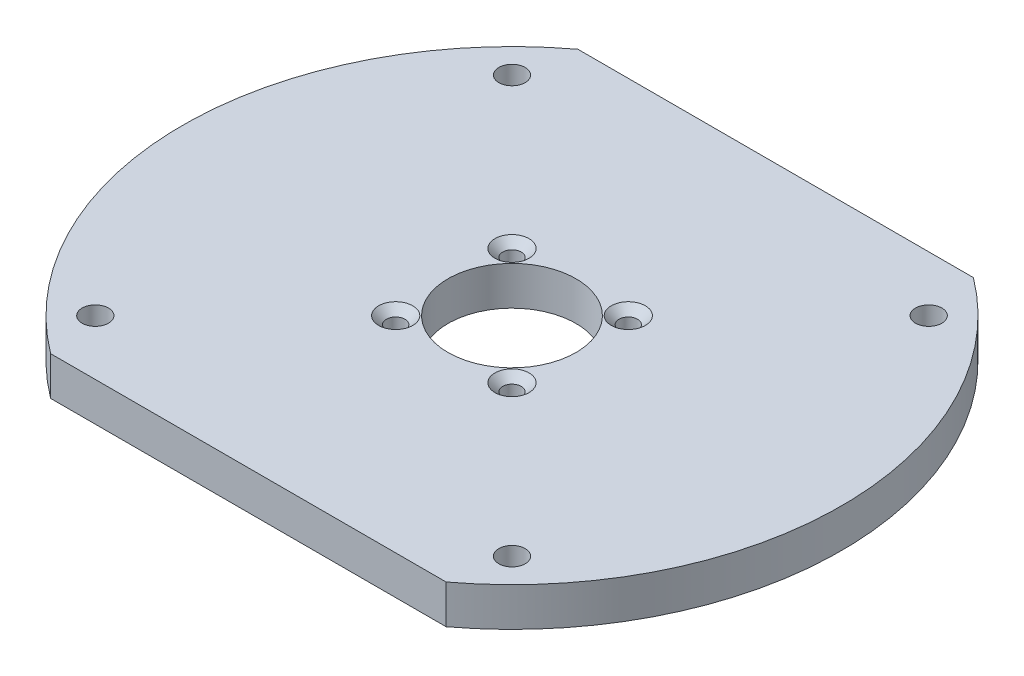
from build123d import *

# Parameters (mm, degrees)
SKETCH_1_R                   = 42.5
EXTRUDE_1_DEPTH              = 5
SKETCH_2_R                   = 8.25
CUT_EXTRUDE_1_DEPTH          = 61.311690409
HOLE_WIZARD_M2_1_D           = 2.4
HOLE_WIZARD_M2_1_CSINK_D     = 4.4
HOLE_WIZARD_M2_1_CSINK_ANGLE = 90
HOLE_WIZARD_M3_1_D           = 3.4
HOLE_WIZARD_M3_1_CSINK_D     = 6.3
HOLE_WIZARD_M3_1_CSINK_ANGLE = 90
PATTERN_CIRCULAR_1_COUNT     = 4
CUT_EXTRUDE_2_DEPTH          = 61.311690409


with BuildPart() as part:
    # 草圖1 → 填料-伸長1 (new body)
    with BuildSketch(Plane(origin=(0, 0, 0), x_dir=(1, 0, 0), z_dir=(0, 1, 0))):
        Circle(SKETCH_1_R)
    extrude(amount=EXTRUDE_1_DEPTH)

    # 草圖2 → 除料-伸長1 (cut, through all)
    with BuildSketch(Plane(origin=(0, 5, 0), x_dir=(1, 0, 0), z_dir=(0, 1, 0))):
        Circle(SKETCH_2_R)
    extrude(amount=-CUT_EXTRUDE_1_DEPTH, mode=Mode.SUBTRACT)

    # M2 錐坑平頭螺釘的錐孔1 (through all)
    with Locations(Plane(origin=(0, 5, 0), x_dir=(1, 0, 0), z_dir=(0, 1, 0))):
        with Locations((-7.5, 7.5), (7.5, 7.5), (7.5, -7.5), (-7.5, -7.5)):
            CounterSinkHole(HOLE_WIZARD_M2_1_D / 2, HOLE_WIZARD_M2_1_CSINK_D / 2, counter_sink_angle=HOLE_WIZARD_M2_1_CSINK_ANGLE)

    # M3 錐坑平頭螺釘的錐孔1 (through all)
    with Locations(Plane(origin=(0, 0, 0), x_dir=(-1, 0, 0), z_dir=(0, -1, 0))):
        with Locations((26.870057685, -26.870057685)):
            hole_wizard_m3_1 = CounterSinkHole(HOLE_WIZARD_M3_1_D / 2, HOLE_WIZARD_M3_1_CSINK_D / 2, counter_sink_angle=HOLE_WIZARD_M3_1_CSINK_ANGLE)

    # 環狀複製排列1: M3 錐坑平頭螺釘的錐孔1 ×4 about axis
    pattern_circular_1_axis = Axis((0, 0, 0), (0, 1, 0))
    for i in range(1, PATTERN_CIRCULAR_1_COUNT):
        add(hole_wizard_m3_1.rotate(pattern_circular_1_axis, i * 360 / PATTERN_CIRCULAR_1_COUNT), mode=Mode.SUBTRACT)

    # 草圖7 → 除料-伸長2 (cut, symmetric)
    with BuildSketch(Plane(origin=(0, 5, 0), x_dir=(1, 0, 0), z_dir=(0, 1, 0))):
        Polygon((240.207107839, -34), (25.5, -34), (-25.5, -34), (-240.207107839, -34), (-240.207107839, -463.414215679), (240.207107839, -463.414215679), align=None)
    cut_extrude_2 = extrude(amount=CUT_EXTRUDE_2_DEPTH, both=True, mode=Mode.SUBTRACT)

    # 鏡射1: 除料-伸長2 across plane
    add(cut_extrude_2.mirror(Plane.XY), mode=Mode.SUBTRACT)


solid = part.part
